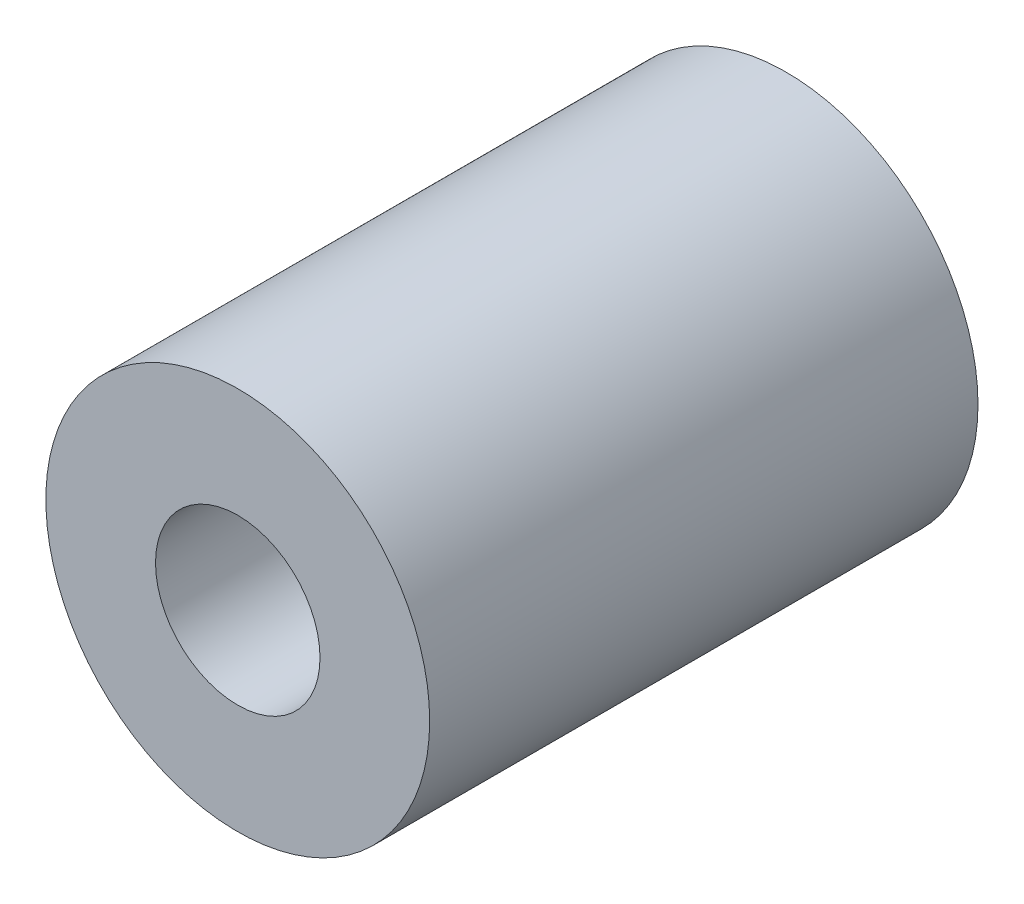
from build123d import *

# Parameters (mm, degrees)
ESQUISSE1_R        = 3.5
ESQUISSE1_R_2      = 1.5
BOSS_EXTRU_1_DEPTH = 10


with BuildPart() as part:
    # Esquisse1 → Boss.-Extru.1 (new body)
    with BuildSketch(Plane.XY):
        Circle(ESQUISSE1_R)
        Circle(ESQUISSE1_R_2, mode=Mode.SUBTRACT)
    extrude(amount=BOSS_EXTRU_1_DEPTH)


solid = part.part
